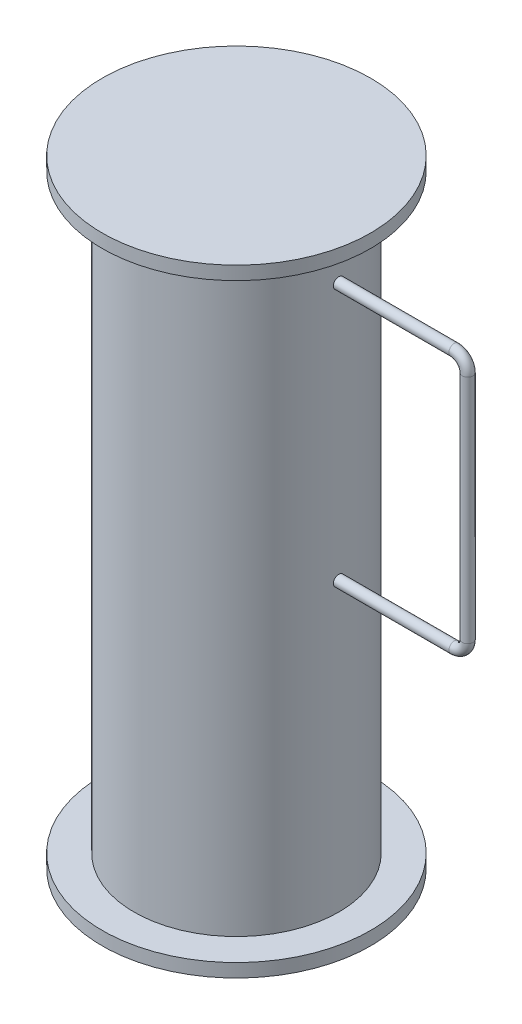
from build123d import *

# Parameters (mm, degrees)
SKETCH_3_R        = 2
SWEEP_2_PROFILE_R = 2


with BuildPart() as part:
    # 草圖1 → 旋轉1 (revolve)
    with BuildSketch(Plane.XY, mode=Mode.PRIVATE) as revolve_1_sk:
        Polygon((0, 5), (0, 0), (50, 0), (50, 5), (38.15, 5), (38.15, 225), (50, 225), (50, 230), (0, 230), (0, 225), (33.15, 225), (33.15, 5), align=None)
    revolve(revolve_1_sk.sketch.rotate(Axis((0, 0, 0), (0, 1, 0)), 90), axis=Axis((0, 0, 0), (0, 1, 0)))

    # 掃出1: sweep along a path in 草圖2
    with BuildLine(Plane.XY) as sweep_1_path:
        Line((0, 208), (81.15, 208))
        ThreePointArc((81.15, 208), (84.685533906, 206.535533906), (86.15, 203))
        Line((86.15, 203), (86.15, 117))
        ThreePointArc((86.15, 117), (84.685533906, 113.464466094), (81.15, 112))
        Line((81.15, 112), (0, 112))
    # 草圖3 → 掃出1 (sweep)
    with BuildSketch(Plane(origin=(0, 0, 0), x_dir=(0, 0, -1), z_dir=(1, 0, 0))):
        with Locations((0, 208)):
            Circle(SKETCH_3_R)
    sweep(path=sweep_1_path.line)


with BuildPart() as body_2:
    # 掃出2: sweep along a path in 草圖4
    with BuildLine(Plane.XY) as sweep_2_path:
        Line((-38.15, 200), (-48.15, 200))
        ThreePointArc((-48.15, 200), (-58.15, 190), (-48.15, 180))
        Line((-48.15, 180), (-38.15, 180))
    # 掃出2 profile (on start of the path) → 掃出2 (sweep)
    with BuildSketch(Plane(origin=(-38.15, 200, 0), x_dir=(0, -1, 0), z_dir=(-1, 0, 0))):
        Circle(SWEEP_2_PROFILE_R)
    sweep(path=sweep_2_path.line)


solid = Compound([part.part, body_2.part])
